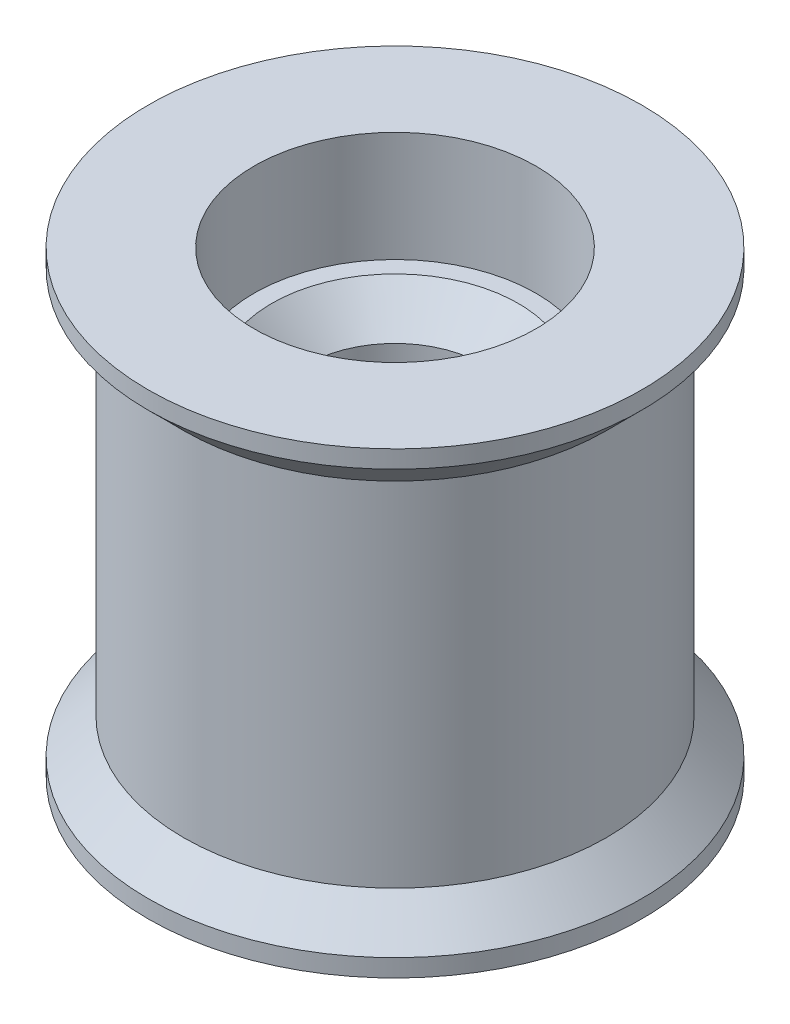
from build123d import *

# Parameters (mm, degrees)
CHAMFER1_SIZE = 1


with BuildPart() as part:
    # Sketch2 → Revolve1 (revolve)
    with BuildSketch(Plane(origin=(0, 0, 0), x_dir=(0, 0, -1), z_dir=(1, 0, 0))):
        Polygon((2.5, 0), (2.5, 3.375), (4, 3.375), (4, 6.5), (7, 6.5), (7, 6), (6, 5), (6, 0), align=None)
    revolve1 = revolve(axis=Axis((0, 0, 0), (0, 1, 0)))

    # Mirror1: Revolve1 across plane
    add(revolve1.mirror(Plane.ZX))

    # Chamfer1
    chamfer1_edges = [part.edges().sort_by_distance(p)[0] for p in [
        (0, -3.375, 2.5),
        (0, 3.375, 2.5),
    ]]
    chamfer(chamfer1_edges, length=CHAMFER1_SIZE)


solid = part.part
